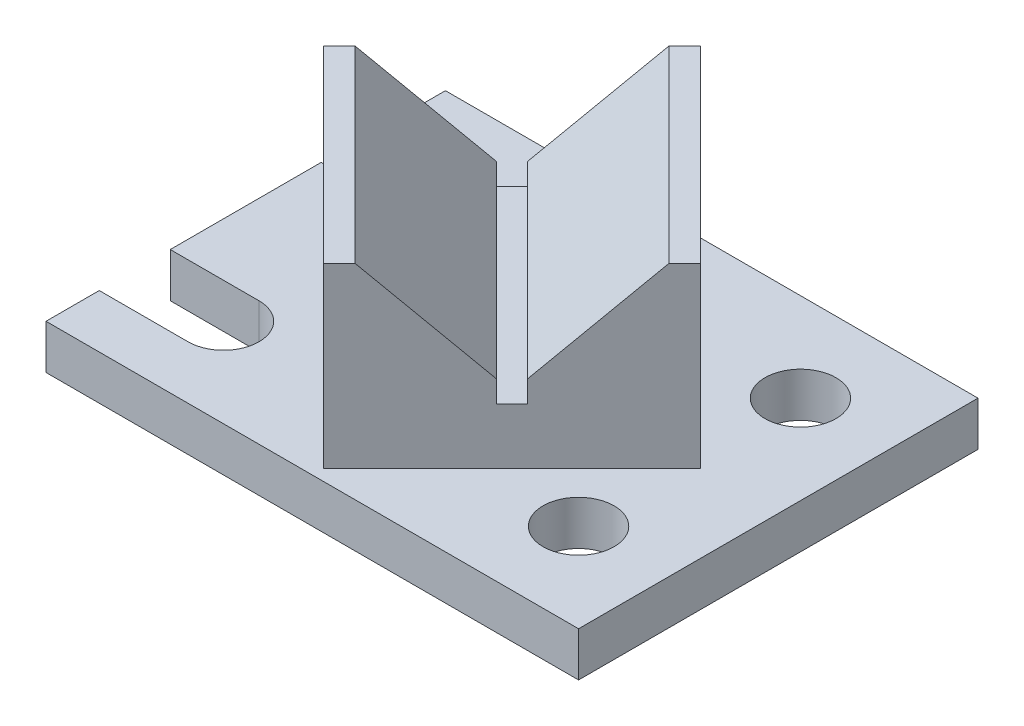
from build123d import *

# Parameters (mm, degrees)
CROQUIS2_W              = 152.4
CROQUIS2_H              = 114.3
SALIENTE_EXTRUIR1_DEPTH = 12.7
CROQUIS3_R              = 10.16
CORTAR_EXTRUIR2_DEPTH   = 97.092936785
SALIENTE_EXTRUIR2_DEPTH = 50.8
CORTAR_EXTRUIR3_DEPTH   = 148.45007773


with BuildPart() as part:
    # Croquis2 → Saliente-Extruir1 (new body)
    with BuildSketch(Plane(origin=(0, 0, 0), x_dir=(1, 0, 0), z_dir=(0, 1, 0))):
        Rectangle(CROQUIS2_W, CROQUIS2_H)
    extrude(amount=SALIENTE_EXTRUIR1_DEPTH)

    # Croquis3 → Cortar-Extruir2 (cut, through all)
    with BuildSketch(Plane(origin=(0, 12.7, 0), x_dir=(1, 0, 0), z_dir=(0, 1, 0))):
        with Locations(Location((50.8, -31.75, 0), (0, 0, 270))):
            Circle(CROQUIS3_R)
        with BuildLine():
            Line((-76.2, -21.59), (-50.8, -21.59))
            ThreePointArc((-50.8, -21.59), (-40.64, -31.75), (-50.8, -41.91))
            Line((-50.8, -41.91), (-76.2, -41.91))
            Line((-76.2, -41.91), (-76.2, -21.59))
        make_face()
    cortar_extruir2 = extrude(amount=-CORTAR_EXTRUIR2_DEPTH, mode=Mode.SUBTRACT)

    # Simetría2: Cortar-Extruir2 across plane
    add(cortar_extruir2.mirror(Plane.XY), mode=Mode.SUBTRACT)

    # Croquis5 → Saliente-Extruir2 (add)
    with BuildSketch(Plane(origin=(0, 12.7, 0), x_dir=(1, 0, 0), z_dir=(0, 1, 0))):
        Polygon((0, -53.881536726), (53.881536726, 0), (0, 53.881536726), (-53.881536726, 0), align=None)
    extrude(amount=SALIENTE_EXTRUIR2_DEPTH)

    # Croquis7 → Cortar-Extruir3 (cut, through all)
    with BuildSketch(Plane(origin=(26.940768363, 0, 26.940768363), x_dir=(0.7071067811865465, 0, -0.7071067811865487), z_dir=(0.7071067811865487, 0, 0.7071067811865465))):
        Polygon((-31.75, 63.5), (31.75, 63.5), (3.175, 34.925), (3.175, 28.702), (-3.175, 28.702), (-3.175, 34.925), align=None)
    extrude(amount=-CORTAR_EXTRUIR3_DEPTH, mode=Mode.SUBTRACT)


solid = part.part
